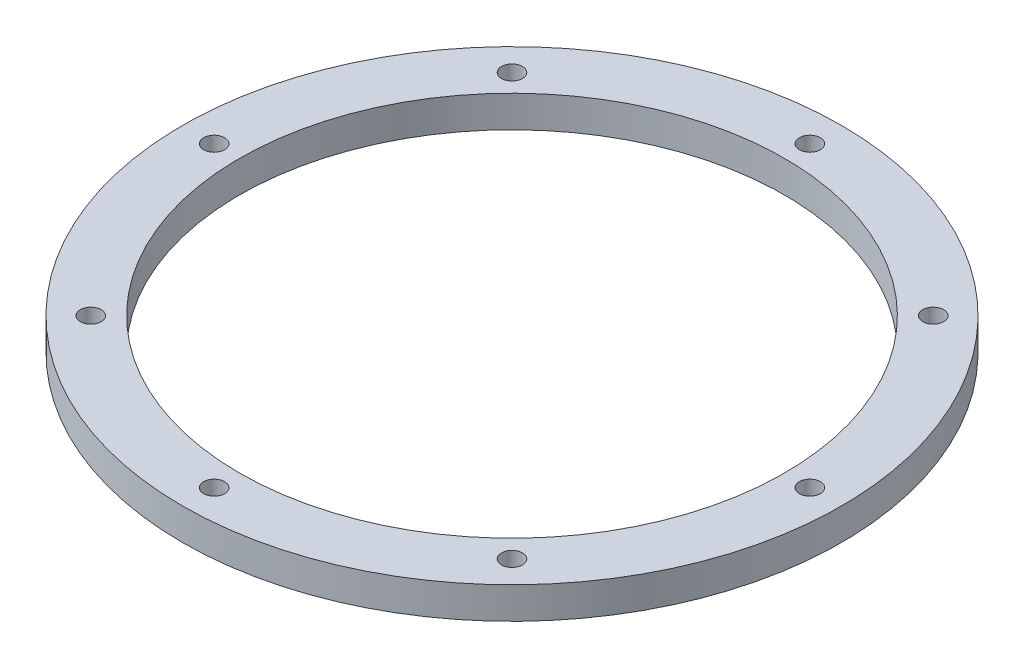
from build123d import *

# Parameters (mm, degrees)
SKETCH_1_R      = 52
SKETCH_1_R_2    = 43
SKETCH_1_R_3    = 1.65
EXTRUDE_1_DEPTH = 5


with BuildPart() as part:
    # 草图1 → 凸台-拉伸1 (new body)
    with BuildSketch(Plane(origin=(0, 0, 0), x_dir=(1, 0, 0), z_dir=(0, 1, 0))):
        with Locations(Location((0, 0, 0), (0, 0, 270))):
            Circle(SKETCH_1_R)
        with Locations(Location((0, 0, 0), (0, 0, 270))):
            Circle(SKETCH_1_R_2, mode=Mode.SUBTRACT)
        with Locations(Location((47, 0, 0), (0, 0, 270))):
            Circle(SKETCH_1_R_3, mode=Mode.SUBTRACT)
        with Locations(Location((33.234018716, -33.234018716, 0), (0, 0, 270))):
            Circle(SKETCH_1_R_3, mode=Mode.SUBTRACT)
        with Locations(Location((0, -47, 0), (0, 0, 270))):
            Circle(SKETCH_1_R_3, mode=Mode.SUBTRACT)
        with Locations(Location((-33.234018716, -33.234018716, 0), (0, 0, 270))):
            Circle(SKETCH_1_R_3, mode=Mode.SUBTRACT)
        with Locations(Location((-47, 0, 0), (0, 0, 270))):
            Circle(SKETCH_1_R_3, mode=Mode.SUBTRACT)
        with Locations(Location((-33.234018716, 33.234018716, 0), (0, 0, 270))):
            Circle(SKETCH_1_R_3, mode=Mode.SUBTRACT)
        with Locations(Location((0, 47, 0), (0, 0, 270))):
            Circle(SKETCH_1_R_3, mode=Mode.SUBTRACT)
        with Locations(Location((33.234018716, 33.234018716, 0), (0, 0, 270))):
            Circle(SKETCH_1_R_3, mode=Mode.SUBTRACT)
    extrude(amount=EXTRUDE_1_DEPTH)


solid = part.part
